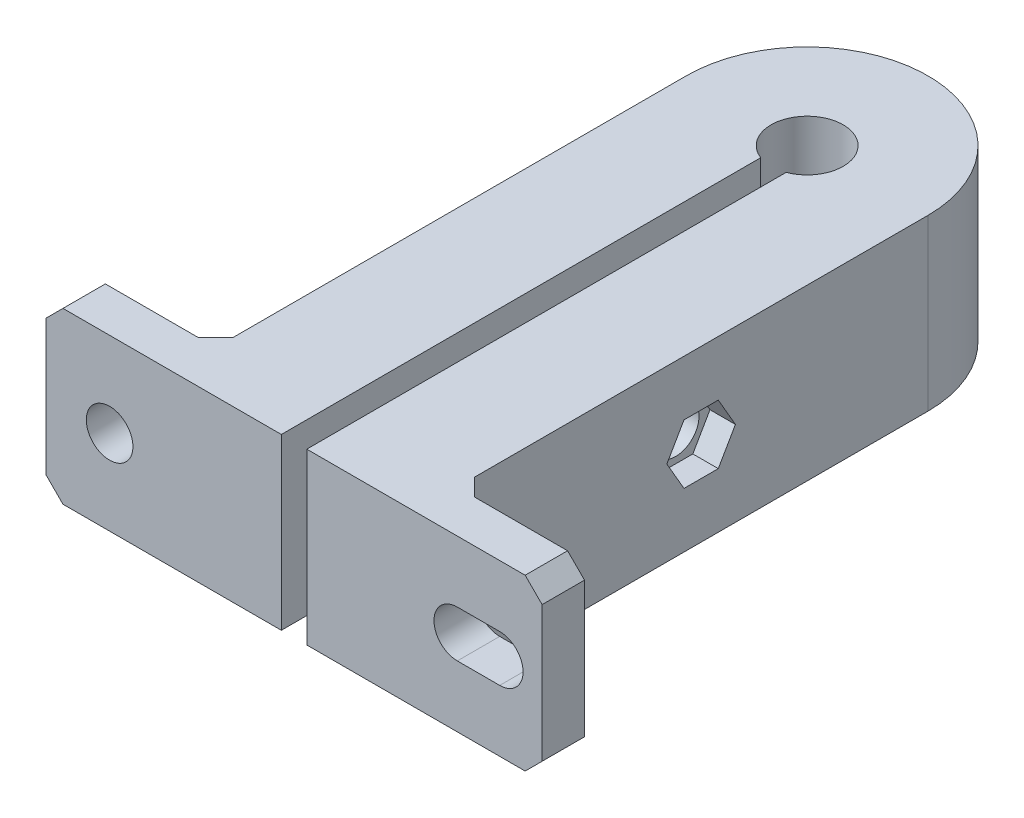
from build123d import *

# Parameters (mm, degrees)
SKETCH1_R                    = 4.25
BOSS_EXTRUDE1_DEPTH          = 20
CUT_EXTRUDE_THIN1_DEPTH      = 66.294046436
CUT_EXTRUDE_THIN1_DEPTH_BACK = 20
SKETCH3_W                    = 3
SKETCH3_H                    = 60.5
SKETCH4_W                    = 27.75
SKETCH4_H                    = 20
BOSS_EXTRUDE2_DEPTH          = 5
SKETCH5_R                    = 2.75
CUT_EXTRUDE1_DEPTH           = 5
CHAMFER1_SIZE                = 2
CHAMFER2_SIZE                = 2
SKETCH6_R                    = 2.75
CUT_EXTRUDE2_DEPTH           = 35
CUT_EXTRUDE3_DEPTH           = 3
SKETCH8_R                    = 4
CUT_EXTRUDE4_DEPTH           = 4


with BuildPart() as part:
    # Sketch1 → Boss-Extrude1 (new body)
    with BuildSketch(Plane(origin=(0, 0, 0), x_dir=(1, 0, 0), z_dir=(0, 1, 0))):
        with BuildLine():
            Line((-14.25, 0), (-14.25, -60.5))
            Line((-14.25, -60.5), (14.25, -60.5))
            Line((14.25, -60.5), (14.25, 0))
            ThreePointArc((14.25, 0), (0, 14.25), (-14.25, 0))
        make_face()
        with Locations(Location((0, 0, 0), (0, 0, 270))):
            Circle(SKETCH1_R, mode=Mode.SUBTRACT)
    extrude(amount=BOSS_EXTRUDE1_DEPTH)

    # Sketch3 → Cut-Extrude-Thin1 (cut, two sides: drawn at the far end of the back side and taken through both)
    with BuildSketch(Plane(origin=(0, 20, 0), x_dir=(1, 0, 0), z_dir=(0, 1, 0)).offset(-CUT_EXTRUDE_THIN1_DEPTH_BACK)):
        with Locations((0, -30.25)):
            Rectangle(SKETCH3_W, SKETCH3_H)
    extrude(amount=CUT_EXTRUDE_THIN1_DEPTH + CUT_EXTRUDE_THIN1_DEPTH_BACK, mode=Mode.SUBTRACT)

    # Sketch4 → Boss-Extrude2 (add)
    with BuildSketch(Plane.XY.offset(60.5)):
        with Locations((-15.375, 10)):
            Rectangle(SKETCH4_W, SKETCH4_H)
    boss_extrude2 = extrude(amount=-BOSS_EXTRUDE2_DEPTH)

    # Mirror1: Boss-Extrude2 across plane
    add(boss_extrude2.mirror(Plane(origin=(0, 0, 0), x_dir=(0, 0, 1), z_dir=(1, 0, 0))))

    # Sketch5 → Cut-Extrude1 (cut)
    with BuildSketch(Plane(origin=(0, 0, 55.5), x_dir=(-1, 0, 0), z_dir=(0, 0, -1))):
        with Locations((21.75, 10)):
            Circle(SKETCH5_R)
        with BuildLine():
            Line((-24.25, 12.75), (-19.25, 12.75))
            ThreePointArc((-19.25, 12.75), (-16.5, 10), (-19.25, 7.25))
            Line((-19.25, 7.25), (-24.25, 7.25))
            ThreePointArc((-24.25, 7.25), (-27, 10), (-24.25, 12.75))
        make_face()
    extrude(amount=-CUT_EXTRUDE1_DEPTH, mode=Mode.SUBTRACT)

    # Chamfer1
    chamfer1_edges = [part.edges().sort_by_distance(p)[0] for p in [
        (-14.25, 10, 55.5),
        (14.25, 10, 55.5),
    ]]
    chamfer(chamfer1_edges, length=CHAMFER1_SIZE)

    # Chamfer2
    chamfer2_edges = [part.edges().sort_by_distance(p)[0] for p in [
        (-29.25, 20, 58),
        (-29.25, 0, 58),
        (29.25, 0, 58),
        (29.25, 20, 58),
    ]]
    chamfer(chamfer2_edges, length=CHAMFER2_SIZE)

    # Sketch6 → Cut-Extrude2 (cut)
    with BuildSketch(Plane(origin=(14.25, 0, 0), x_dir=(0, 0, -1), z_dir=(1, 0, 0))):
        with Locations((-26.75, 10)):
            Circle(SKETCH6_R)
    extrude(amount=-CUT_EXTRUDE2_DEPTH, mode=Mode.SUBTRACT)

    # Sketch7 → Cut-Extrude3 (cut)
    with BuildSketch(Plane(origin=(14.25, 0, 0), x_dir=(0, 0, -1), z_dir=(1, 0, 0))):
        Polygon((-22.708548116, 10), (-24.729274058, 13.5), (-28.770725942, 13.5), (-30.791451884, 10), (-28.770725942, 6.5), (-24.729274058, 6.5), align=None)
    extrude(amount=-CUT_EXTRUDE3_DEPTH, mode=Mode.SUBTRACT)

    # Sketch8 → Cut-Extrude4 (cut)
    with BuildSketch(Plane.ZY.offset(14.25)):
        with Locations((26.75, 10)):
            Circle(SKETCH8_R)
    extrude(amount=-CUT_EXTRUDE4_DEPTH, mode=Mode.SUBTRACT)


solid = part.part
